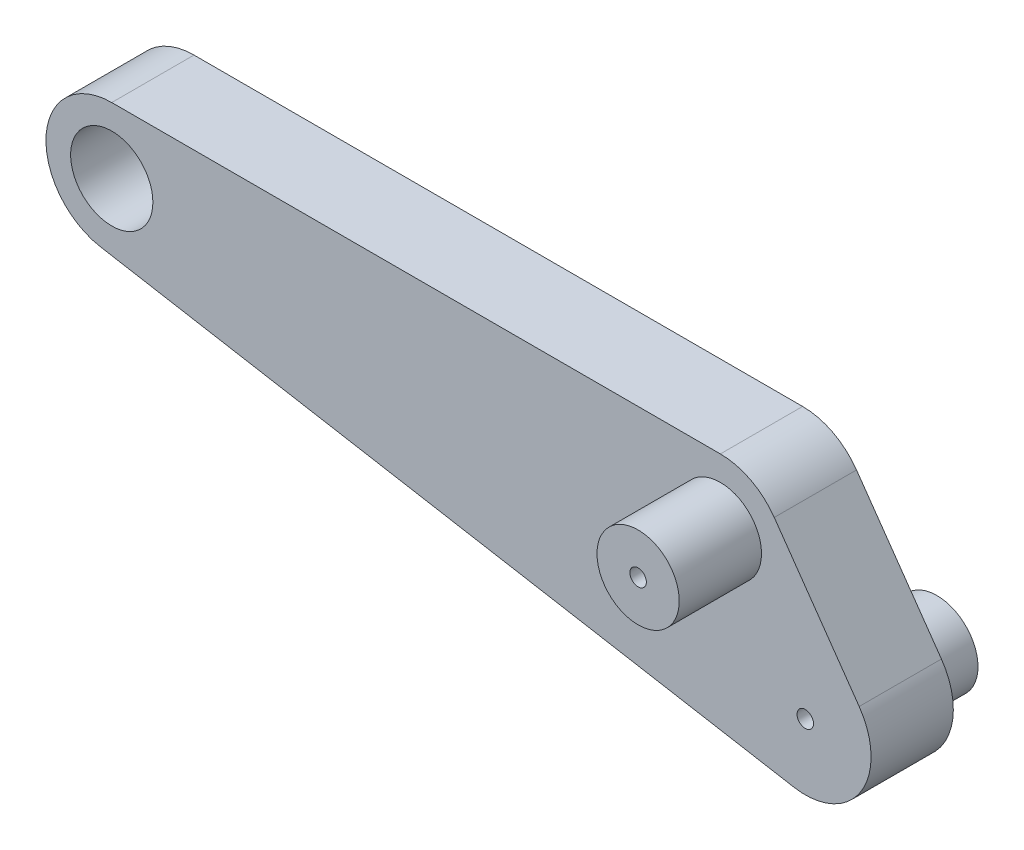
from build123d import *

# Parameters (mm, degrees)
SKETCH2_R           = 2.5
BOSS_EXTRUDE1_DEPTH = 5
BOSS_EXTRUDE2_START = -8
SKETCH3_R           = 2.5
SKETCH3_R_2         = 0.5
BOSS_EXTRUDE2_DEPTH = 8
SKETCH4_R           = 2.5
SKETCH4_R_2         = 0.5
BOSS_EXTRUDE3_DEPTH = 10


with BuildPart() as part:
    # Sketch2 → Boss-Extrude1 (new body)
    with BuildSketch(Plane.XY):
        with BuildLine():
            Line((-37, 4), (0, 4))
            ThreePointArc((0, 4), (1.846994453, 3.548043333), (3.276608177, 2.294305745))
            Line((3.276608177, 2.294305745), (8.438796104, -5.078062653))
            ThreePointArc((8.438796104, -5.078062653), (8.537284882, -9.519161483), (4.473211982, -11.31258567))
            Line((4.473211982, -11.31258567), (-37.688975946, -3.940217271))
            ThreePointArc((-37.688975946, -3.940217271), (-40.985026291, 0.345782384), (-37, 4))
        make_face()
        with Locations((-37, 0)):
            Circle(SKETCH2_R, mode=Mode.SUBTRACT)
        Circle(SKETCH2_R, mode=Mode.SUBTRACT)
        with Locations((5.162187927, -7.372368399)):
            Circle(SKETCH2_R, mode=Mode.SUBTRACT)
    extrude(amount=BOSS_EXTRUDE1_DEPTH)

    # Sketch3 → Boss-Extrude2 (add)
    with BuildSketch(Plane.XY.offset(5).offset(BOSS_EXTRUDE2_START)):
        with Locations((5.162187927, -7.372368399)):
            Circle(SKETCH3_R)
        with Locations((5.162187927, -7.372368399)):
            Circle(SKETCH3_R_2, mode=Mode.SUBTRACT)
    extrude(amount=BOSS_EXTRUDE2_DEPTH)

    # Sketch4 → Boss-Extrude3 (add)
    with BuildSketch(Plane(origin=(0, 0, 0), x_dir=(-1, 0, 0), z_dir=(0, 0, -1))):
        Circle(SKETCH4_R)
        Circle(SKETCH4_R_2, mode=Mode.SUBTRACT)
    extrude(amount=-BOSS_EXTRUDE3_DEPTH)


solid = part.part
